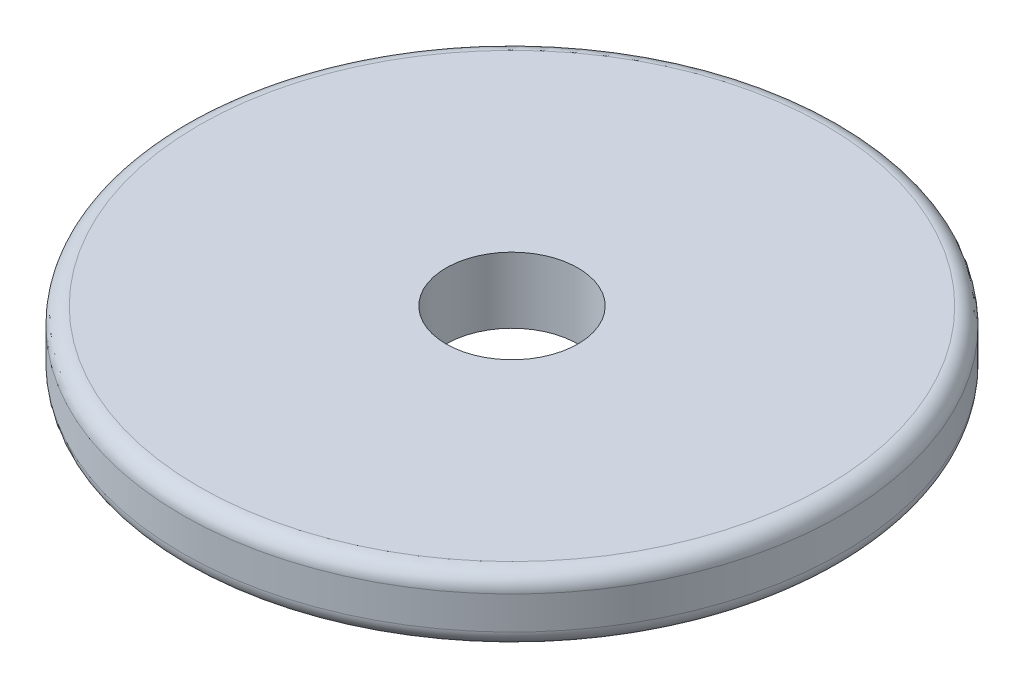
from build123d import *

# Parameters (mm, degrees)
SKETCH_1_R      = 100
SKETCH_1_R_2    = 20
EXTRUDE_1_DEPTH = 20
FILLET_1_R      = 5


with BuildPart() as part:
    # 草图1 → 凸台-拉伸1 (new body)
    with BuildSketch(Plane(origin=(0, 0, 0), x_dir=(1, 0, 0), z_dir=(0, 1, 0))):
        with Locations(Location((0, 0, 0), (0, 0, 270))):
            Circle(SKETCH_1_R)
        with Locations(Location((0, 0, 0), (0, 0, 270))):
            Circle(SKETCH_1_R_2, mode=Mode.SUBTRACT)
    extrude(amount=EXTRUDE_1_DEPTH)

    # 圆角1
    fillet_1_edges = [part.edges().sort_by_distance(p)[0] for p in [
        (0, 0, -100),
        (0, 20, -100),
    ]]
    fillet(fillet_1_edges, radius=FILLET_1_R)


solid = part.part
